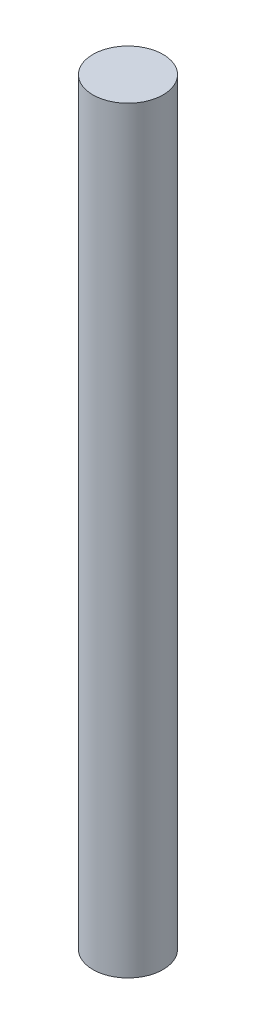
from build123d import *

# Parameters (mm, degrees)
SKETCH1_R           = 3.175
BOSS_EXTRUDE1_DEPTH = 68.58


with BuildPart() as part:
    # Sketch1 → Boss-Extrude1 (new body)
    with BuildSketch(Plane(origin=(0, 0, 0), x_dir=(1, 0, 0), z_dir=(0, 1, 0))):
        with Locations(Location((0, 0, 0), (0, 0, 270))):
            Circle(SKETCH1_R)
    extrude(amount=BOSS_EXTRUDE1_DEPTH)


solid = part.part
